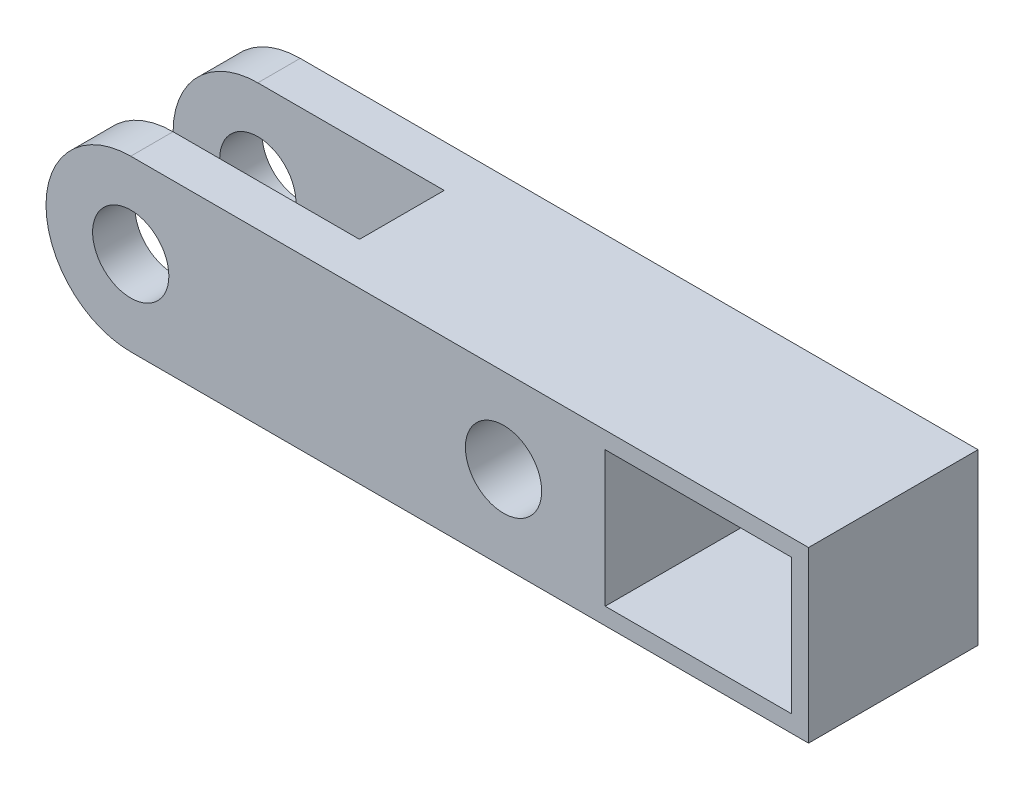
from build123d import *

# Parameters (mm, degrees)
SKETCH1_R           = 2.25
BOSS_EXTRUDE1_DEPTH = 5
SKETCH2_R           = 2.25
CUT_EXTRUDE2_DEPTH  = 43.426406871
SKETCH4_W           = 11
SKETCH4_H           = 8
CUT_EXTRUDE5_DEPTH  = 42.533119315
SKETCH5_W           = 16
SKETCH5_H           = 5
CUT_EXTRUDE6_DEPTH  = 42.533119315


with BuildPart() as part:
    # Sketch1 → Boss-Extrude1 (new, symmetric)
    with BuildSketch(Plane.XY):
        with BuildLine():
            Line((0, 5), (40, 5))
            Line((40, 5), (40, -5))
            Line((40, -5), (0, -5))
            ThreePointArc((0, -5), (-5, 0), (0, 5))
        make_face()
        Circle(SKETCH1_R, mode=Mode.SUBTRACT)
    extrude(amount=BOSS_EXTRUDE1_DEPTH, both=True)

    # Sketch2 → Cut-Extrude2 (cut, through all)
    with BuildSketch(Plane(origin=(0, -5, 5), x_dir=(1, 0, 0), z_dir=(0, 0, -1))):
        with Locations(Location((22, -5, 0), (0, 0, 180))):
            Circle(SKETCH2_R)
    extrude(amount=CUT_EXTRUDE2_DEPTH, mode=Mode.SUBTRACT)

    # Sketch4 → Cut-Extrude5 (cut, through all)
    with BuildSketch(Plane(origin=(0, 0, 5), x_dir=(-1, 0, 0), z_dir=(0, 0, -1))):
        with Locations((-33.5, 0)):
            Rectangle(SKETCH4_W, SKETCH4_H)
    extrude(amount=CUT_EXTRUDE5_DEPTH, mode=Mode.SUBTRACT)

    # Sketch5 → Cut-Extrude6 (cut, through all)
    with BuildSketch(Plane.XZ.offset(5)):
        with Locations((3, 0)):
            Rectangle(SKETCH5_W, SKETCH5_H)
    extrude(amount=-CUT_EXTRUDE6_DEPTH, mode=Mode.SUBTRACT)


solid = part.part
